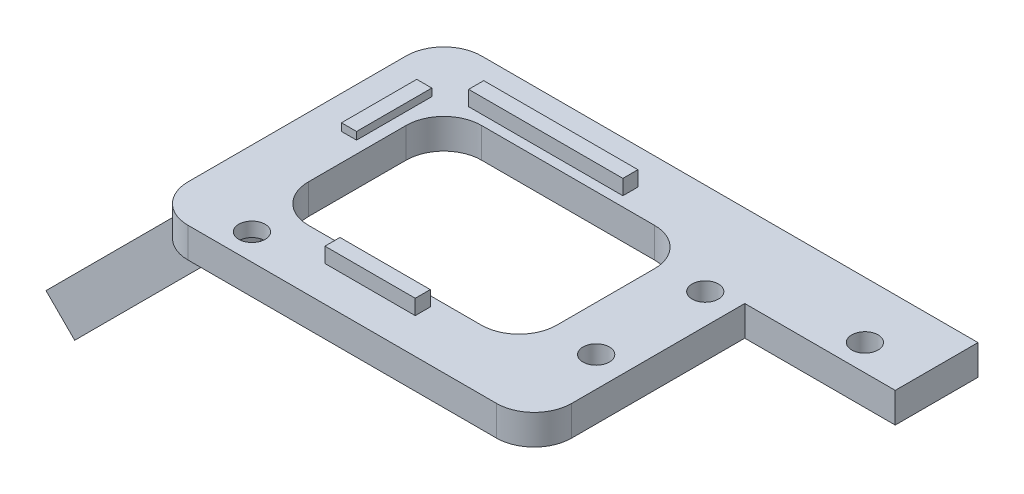
from build123d import *

# Parameters (mm, degrees)
SKETCH1_W                       = 51
SKETCH1_H                       = 39
SKETCH1_R                       = 1.75
SKETCH1_W_2                     = 33
SKETCH1_H_2                     = 23
BOSS_EXTRUDE1_DEPTH             = 4
FILLET1_R                       = 5
SKETCH2_W                       = 20.5
SKETCH2_H                       = 2
SKETCH2_W_2                     = 12
BOSS_EXTRUDE4_DEPTH             = 2
FILLET5_R                       = 5
CUT_EXTRUDE1_DEPTH              = 2.1
SKETCH5_W                       = 2
SKETCH5_H                       = 10
BOSS_EXTRUDE5_DEPTH             = 1
BOSS_EXTRUDE6_DEPTH             = 7
BOSS_EXTRUDE6_DEPTH_BACK        = 7
SKETCH7_R                       = 1.75
CUT_EXTRUDE2_DEPTH              = 5.394590795
BOSS_EXTRUDE7_REACH             = 61.994
SKETCH8_R                       = 1.75
SKETCH10_W                      = 11
SKETCH10_H                      = 4
BOSS_EXTRUDE9_DEPTH             = 20
BOSS_EXTRUDE9_DIRECTION_2_REACH = 91.634
SKETCH11_R                      = 1.75
CUT_EXTRUDE3_DEPTH              = 4


with BuildPart() as part:
    # Sketch1 → Boss-Extrude1 (new body)
    with BuildSketch(Plane(origin=(0, 0, 0), x_dir=(1, 0, 0), z_dir=(0, 1, 0))):
        with Locations((1, 0)):
            Rectangle(SKETCH1_W, SKETCH1_H)
        with Locations(Location((22.5, 7.25, 0), (0, 0, 270))):
            Circle(SKETCH1_R, mode=Mode.SUBTRACT)
        with Locations(Location((22.5, -7.25, 0), (0, 0, 90))):
            Circle(SKETCH1_R, mode=Mode.SUBTRACT)
        with Locations(Location((-14.5, -16, 0), (0, 0, 270))):
            Circle(SKETCH1_R, mode=Mode.SUBTRACT)
        Rectangle(SKETCH1_W_2, SKETCH1_H_2, mode=Mode.SUBTRACT)
    extrude(amount=BOSS_EXTRUDE1_DEPTH)

    # Fillet1
    fillet1_edges = [part.edges().sort_by_distance(p)[0] for p in [
        (-16.5, 2, -11.5),
        (-16.5, 2, 11.5),
        (16.5, 2, 11.5),
        (16.5, 2, -11.5),
    ]]
    fillet(fillet1_edges, radius=FILLET1_R)

    # Sketch2 → Boss-Extrude4 (add)
    with BuildSketch(Plane(origin=(0, 4, 0), x_dir=(1, 0, 0), z_dir=(0, 1, 0))):
        with Locations((-4.25, 13.8)):
            Rectangle(SKETCH2_W, SKETCH2_H)
        with Locations((0, -13.8)):
            Rectangle(SKETCH2_W_2, SKETCH2_H)
    extrude(amount=BOSS_EXTRUDE4_DEPTH)

    # Fillet5
    fillet5_edges = [part.edges().sort_by_distance(p)[0] for p in [
        (-24.5, 2, -19.5),
        (26.5, 2, -19.5),
        (26.5, 2, 19.5),
        (-24.5, 2, 19.5),
    ]]
    fillet(fillet5_edges, radius=FILLET5_R)

    # Sketch4 → Cut-Extrude1 (cut)
    with BuildSketch(Plane.XZ):
        Polygon((-12.854551733, 13.15), (-11.209103466, 16), (-12.854551733, 18.85), (-16.145448267, 18.85), (-17.790896534, 16), (-16.145448267, 13.15), align=None)
    extrude(amount=-CUT_EXTRUDE1_DEPTH, mode=Mode.SUBTRACT)

    # Sketch5 → Boss-Extrude5 (add)
    with BuildSketch(Plane(origin=(0, 4, 0), x_dir=(1, 0, 0), z_dir=(0, 1, 0))):
        with Locations((-19.1, 6.5)):
            Rectangle(SKETCH5_W, SKETCH5_H)
    extrude(amount=BOSS_EXTRUDE5_DEPTH)

    # Sketch6 → Boss-Extrude6 (add, two sides: drawn at the far end of the back side and taken through both)
    with BuildSketch(Plane.XY.offset(-BOSS_EXTRUDE6_DEPTH_BACK)):
        Polygon((-50.875844123, -25.455844123), (-25.42, 0), (-17.790896534, 0), (-47.06129239, -29.270395856), align=None)
    extrude(amount=BOSS_EXTRUDE6_DEPTH + BOSS_EXTRUDE6_DEPTH_BACK)

    # Sketch7 → Cut-Extrude2 (cut)
    with BuildSketch(Plane(origin=(-8.895448267, 8.895448267, 0), x_dir=(0, 0, -1), z_dir=(0.7071067811865489, -0.7071067811865462, 0))):
        with Locations(Location((0, -45.974654378, 0), (0, 0, 90))):
            Circle(SKETCH7_R)
    extrude(amount=-CUT_EXTRUDE2_DEPTH, mode=Mode.SUBTRACT)

    # Boss-Extrude7: up to this face of the body (flat: up to its plane)
    boss_extrude7_end = Plane(part.part.faces().sort_by_distance((-38.010311721, -12.590311721, 0))[0])
    # Sketch8 → Boss-Extrude7 (add, up to the picked face)
    with BuildSketch(Plane(origin=(-8.895448267, 8.895448267, 0), x_dir=(0, 0, -1), z_dir=(0.7071067811865489, -0.7071067811865462, 0)), mode=Mode.PRIVATE) as boss_extrude7_sk1:
        Polygon((7, -12.580063583), (33.15474804, -48.713282576), (25.054188906, -54.576808966), (7, -29.634647011), align=None)
        with Locations(Location((25, -45.974654378, 0), (0, 0, 90))):
            Circle(SKETCH8_R, mode=Mode.SUBTRACT)
    boss_extrude7_tool1 = split(extrude(boss_extrude7_sk1.sketch, amount=-BOSS_EXTRUDE7_REACH, mode=Mode.PRIVATE), bisect_by=boss_extrude7_end, keep=Keep.BOTH, mode=Mode.PRIVATE)
    add(boss_extrude7_tool1.solids().sort_by(Axis((-34.185622, -16.394725, -17.997204), (-0.7071067811865489, 0.7071067811865462, 0)))[0])

    # Sketch10 → Boss-Extrude9 (add)
    with BuildSketch(Plane(origin=(26.5, 0, 0), x_dir=(0, 0, -1), z_dir=(1, 0, 0))):
        with Locations((14, 2)):
            Rectangle(SKETCH10_W, SKETCH10_H)
    extrude(amount=BOSS_EXTRUDE9_DEPTH)

    # Sketch10 → Boss-Extrude9 direction 2 (add, up to next)
    with BuildSketch(Plane(origin=(26.5, 0, 0), x_dir=(0, 0, -1), z_dir=(1, 0, 0)), mode=Mode.PRIVATE) as boss_extrude9_direction_2_sk1:
        with Locations((14, 2)):
            Rectangle(SKETCH10_W, SKETCH10_H)
    boss_extrude9_direction_2_tool1 = extrude(boss_extrude9_direction_2_sk1.sketch, amount=-BOSS_EXTRUDE9_DIRECTION_2_REACH, mode=Mode.PRIVATE) - part.part
    add(boss_extrude9_direction_2_tool1.solids().sort_by_distance((26.5, 2, -14))[0])

    # Sketch11 → Cut-Extrude3 (cut)
    with BuildSketch(Plane(origin=(0, 4, 0), x_dir=(1, 0, 0), z_dir=(0, 1, 0))):
        with Locations(Location((38.97, 12, 0), (0, 0, 270))):
            Circle(SKETCH11_R)
    extrude(amount=-CUT_EXTRUDE3_DEPTH, mode=Mode.SUBTRACT)


solid = part.part
